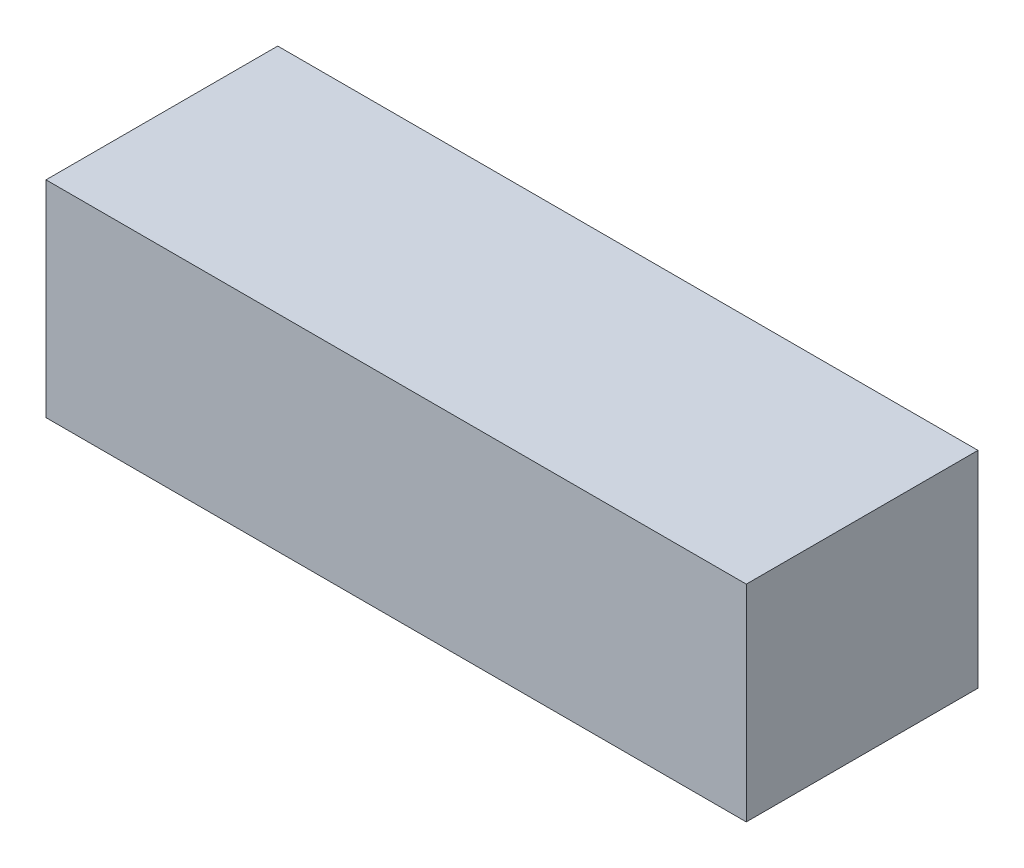
from build123d import *

# Parameters (mm, degrees)
SKETCH1_W           = 136
SKETCH1_H           = 40
BOSS_EXTRUDE1_DEPTH = 45


with BuildPart() as part:
    # Sketch1 → Boss-Extrude1 (new body)
    with BuildSketch(Plane.XY):
        Rectangle(SKETCH1_W, SKETCH1_H)
    extrude(amount=BOSS_EXTRUDE1_DEPTH)


solid = part.part
